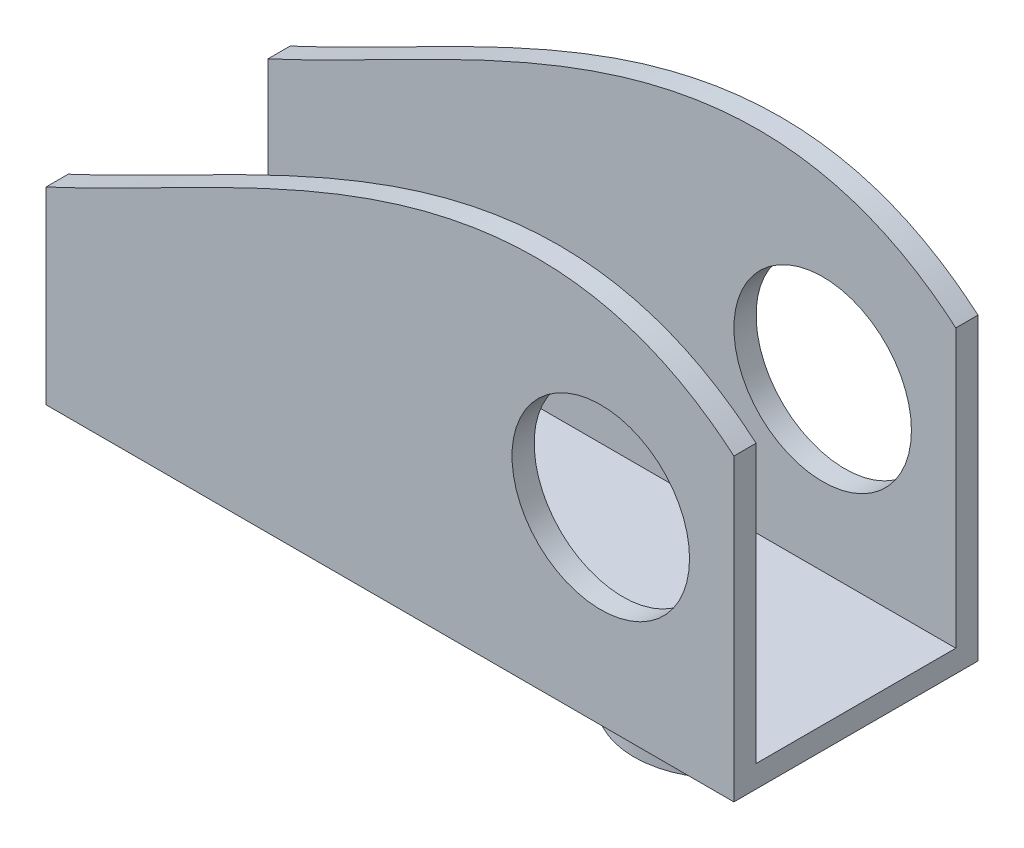
from build123d import *

# Parameters (mm, degrees)
SKETCH1_W           = 310
SKETCH1_H           = 85
BOSS_EXTRUDE1_DEPTH = 10
SKETCH2_W           = 310
SKETCH2_H           = 100
BOSS_EXTRUDE2_DEPTH = 10
SKETCH3_R           = 40
CUT_EXTRUDE1_DEPTH  = 10
SKETCH4_R           = 40
BOSS_EXTRUDE3_DEPTH = 20


with BuildPart() as part:
    # Sketch1 → Boss-Extrude1 (new body)
    with BuildSketch(Plane.XY):
        with Locations((-95, 42.5)):
            Rectangle(SKETCH1_W, SKETCH1_H)
        with BuildLine():
            Line((-250, 85), (0, 85))
            Line((0, 85), (0, 165))
            add(Edge.make_bspline(
                [(-250, 85), (-173.352632869, 120.304599368), (-81.564360867, 181.904903874), (0, 165)],
                knots=[0, 0, 0, 0, 0.796760971, 0.796760971, 0.796760971, 0.796760971], degree=3))
        make_face()
        with BuildLine():
            Line((0, 85), (60, 85))
            Line((60, 85), (60, 135))
            add(Edge.make_bspline(
                [(0, 165), (20.805564215, 160.687870789), (40.945893284, 151.267674504), (60, 135)],
                knots=[0.796760971, 0.796760971, 0.796760971, 0.796760971, 1, 1, 1, 1], degree=3))
            Line((0, 165), (0, 85))
        make_face()
    boss_extrude1 = extrude(amount=-BOSS_EXTRUDE1_DEPTH)

    # Sketch2 → Boss-Extrude2 (add)
    with BuildSketch(Plane(origin=(0, 0, 0), x_dir=(1, 0, 0), z_dir=(0, 1, 0))):
        with Locations((-95, 60)):
            Rectangle(SKETCH2_W, SKETCH2_H)
    extrude(amount=BOSS_EXTRUDE2_DEPTH)

    # Sketch3 → Cut-Extrude1 (cut)
    with BuildSketch(Plane.XY):
        with Locations((0, 85)):
            Circle(SKETCH3_R)
    cut_extrude1 = extrude(amount=-CUT_EXTRUDE1_DEPTH, mode=Mode.SUBTRACT)

    # Mirror1: Boss-Extrude1, Cut-Extrude1 across plane
    add(boss_extrude1.mirror(Plane(origin=(0, 0, -55), x_dir=(1, 0, 0), z_dir=(0, 0, -1))))
    add(cut_extrude1.mirror(Plane(origin=(0, 0, -55), x_dir=(1, 0, 0), z_dir=(0, 0, -1))), mode=Mode.SUBTRACT)

    # Sketch4 → Boss-Extrude3 (add)
    with BuildSketch(Plane.XZ):
        with Locations(Location((0, -55, 0), (0, 0, 180))):
            Circle(SKETCH4_R)
    extrude(amount=BOSS_EXTRUDE3_DEPTH)


solid = part.part
